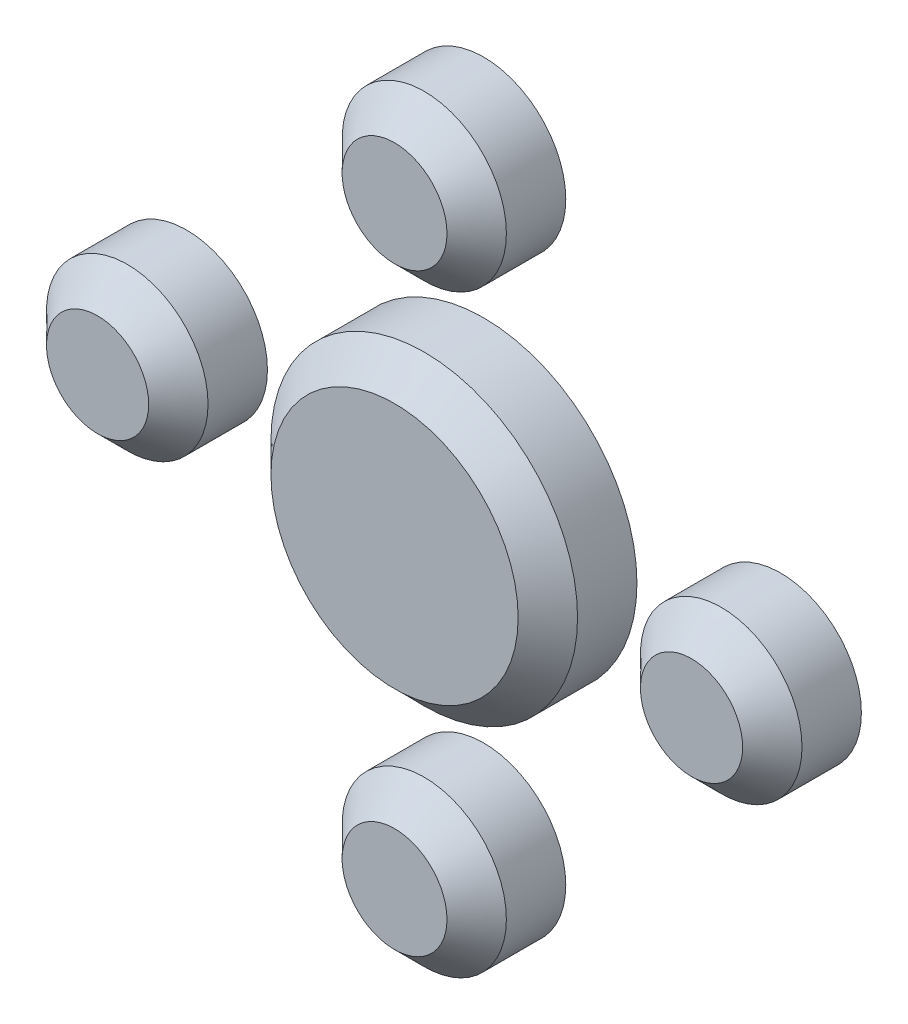
from build123d import *

# Parameters (mm, degrees)
SKETCH1_R             = 5.162028718
BOSS_EXTRUDE1_DEPTH   = 3
SKETCH1_R_2           = 2.765423897
BOSS_EXTRUDE1_2_DEPTH = 3
BOSS_EXTRUDE1_3_DEPTH = 3
SKETCH1_R_3           = 2.719930831
BOSS_EXTRUDE1_4_DEPTH = 3
BOSS_EXTRUDE1_5_DEPTH = 3
CHAMFER2_SIZE         = 1
CHAMFER3_SIZE         = 1
CHAMFER4_SIZE         = 1
CHAMFER5_SIZE         = 1
CHAMFER6_SIZE         = 1


with BuildPart() as part:
    # Sketch1 → Boss-Extrude1 (new body)
    with BuildSketch(Plane.XY):
        Circle(SKETCH1_R)
    extrude(amount=BOSS_EXTRUDE1_DEPTH)

    # Chamfer6
    chamfer6_edges = [part.edges().sort_by_distance(p)[0] for p in [
        (-5.162028718, 0, 3),
    ]]
    chamfer(chamfer6_edges, length=CHAMFER6_SIZE)


with BuildPart() as body_2:
    # Sketch1 → Boss-Extrude1 2 (new body)
    with BuildSketch(Plane.XY):
        with Locations((0, 10)):
            Circle(SKETCH1_R_2)
    extrude(amount=BOSS_EXTRUDE1_2_DEPTH)

    # Chamfer2
    chamfer2_edges = [body_2.edges().sort_by_distance(p)[0] for p in [
        (-2.765423897, 10, 3),
    ]]
    chamfer(chamfer2_edges, length=CHAMFER2_SIZE)


with BuildPart() as body_3:
    # Sketch1 → Boss-Extrude1 3 (new body)
    with BuildSketch(Plane.XY):
        with Locations((0, -10)):
            Circle(SKETCH1_R_2)
    extrude(amount=BOSS_EXTRUDE1_3_DEPTH)

    # Chamfer5
    chamfer5_edges = [body_3.edges().sort_by_distance(p)[0] for p in [
        (-2.765423897, -10, 3),
    ]]
    chamfer(chamfer5_edges, length=CHAMFER5_SIZE)


with BuildPart() as body_4:
    # Sketch1 → Boss-Extrude1 4 (new body)
    with BuildSketch(Plane.XY):
        with Locations((-10, 0)):
            Circle(SKETCH1_R_3)
    extrude(amount=BOSS_EXTRUDE1_4_DEPTH)

    # Chamfer4
    chamfer4_edges = [body_4.edges().sort_by_distance(p)[0] for p in [
        (-12.719930831, 0, 3),
    ]]
    chamfer(chamfer4_edges, length=CHAMFER4_SIZE)


with BuildPart() as body_5:
    # Sketch1 → Boss-Extrude1 5 (new body)
    with BuildSketch(Plane.XY):
        with Locations((10, 0)):
            Circle(SKETCH1_R_3)
    extrude(amount=BOSS_EXTRUDE1_5_DEPTH)

    # Chamfer3
    chamfer3_edges = [body_5.edges().sort_by_distance(p)[0] for p in [
        (7.280069169, 0, 3),
    ]]
    chamfer(chamfer3_edges, length=CHAMFER3_SIZE)


solid = Compound([part.part, body_2.part, body_3.part, body_4.part, body_5.part])
